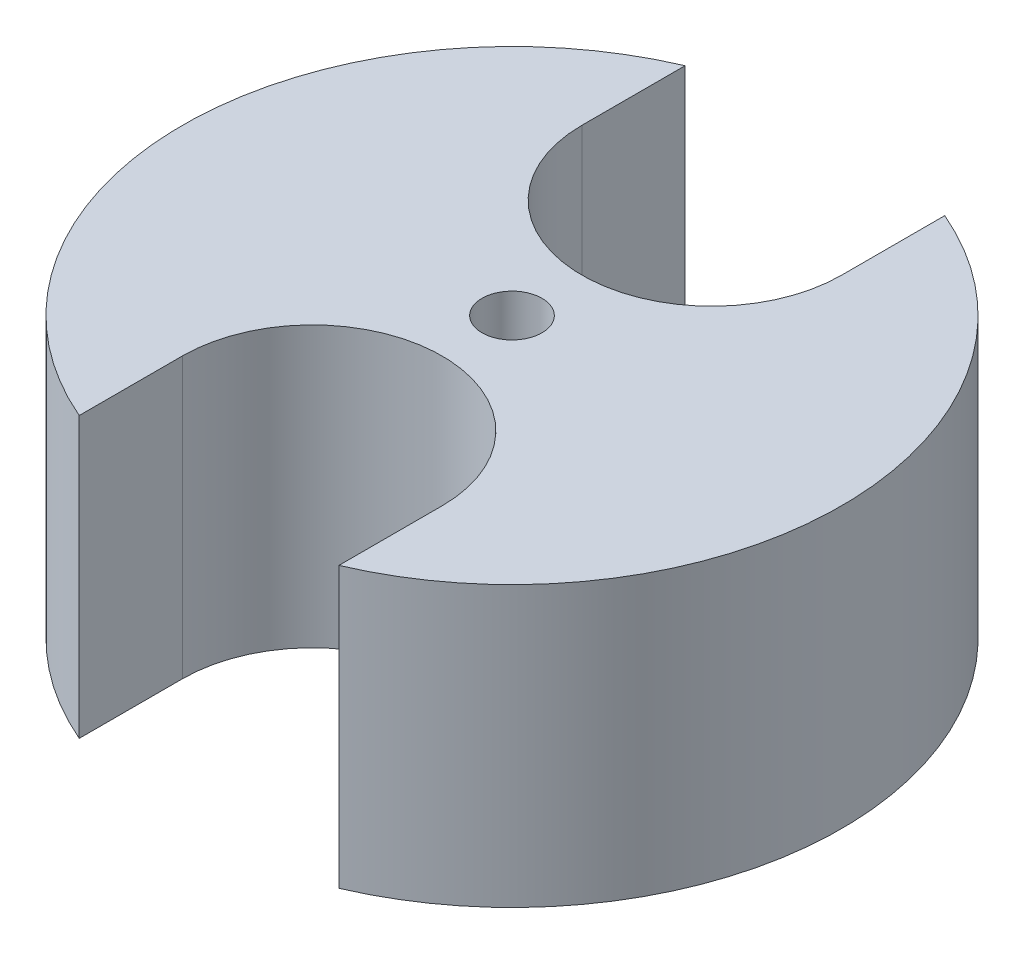
from build123d import *

# Parameters (mm, degrees)
BOSS_EXTRUDE1_DEPTH = 14
SKETCH2_R           = 3
BOSS_EXTRUDE2_DEPTH = 3
CUT_EXTRUDE1_DEPTH  = 8
CUT_EXTRUDE2_START  = -6
SKETCH4_R           = 1.5
CUT_EXTRUDE2_DEPTH  = 6


with BuildPart() as part:
    # Sketch1 → Boss-Extrude1 (new body)
    with BuildSketch(Plane(origin=(0, 0, 0), x_dir=(1, 0, 0), z_dir=(0, 1, 0))):
        with BuildLine():
            Line((-6.5, 15.165750888), (-6.5, 10))
            ThreePointArc((-6.5, 10), (0, 3.5), (6.5, 10))
            Line((6.5, 10), (6.5, 15.165750888))
            ThreePointArc((6.5, 15.165750888), (16.5, 0), (6.5, -15.165750888))
            Line((6.5, -15.165750888), (6.5, -10))
            ThreePointArc((6.5, -10), (0, -3.5), (-6.5, -10))
            Line((-6.5, -10), (-6.5, -15.165750888))
            ThreePointArc((-6.5, -15.165750888), (-16.5, 0), (-6.5, 15.165750888))
        make_face()
    extrude(amount=BOSS_EXTRUDE1_DEPTH)

    # Sketch2 → Boss-Extrude2 (add)
    with BuildSketch(Plane.XZ):
        Circle(SKETCH2_R)
    extrude(amount=BOSS_EXTRUDE2_DEPTH)

    # Sketch3 → Cut-Extrude1 (cut)
    with BuildSketch(Plane.XZ.offset(3)):
        with BuildLine():
            Line((0.997797575, 1.12), (0.997797575, -1.12))
            ThreePointArc((0.997797575, -1.12), (-1.5, 0), (0.997797575, 1.12))
        make_face()
    extrude(amount=-CUT_EXTRUDE1_DEPTH, mode=Mode.SUBTRACT)

    # Sketch4 → Cut-Extrude2 (cut)
    with BuildSketch(Plane(origin=(0, 14, 0), x_dir=(1, 0, 0), z_dir=(0, 1, 0)).offset(CUT_EXTRUDE2_START)):
        Circle(SKETCH4_R)
    extrude(amount=CUT_EXTRUDE2_DEPTH, mode=Mode.SUBTRACT)


solid = part.part
